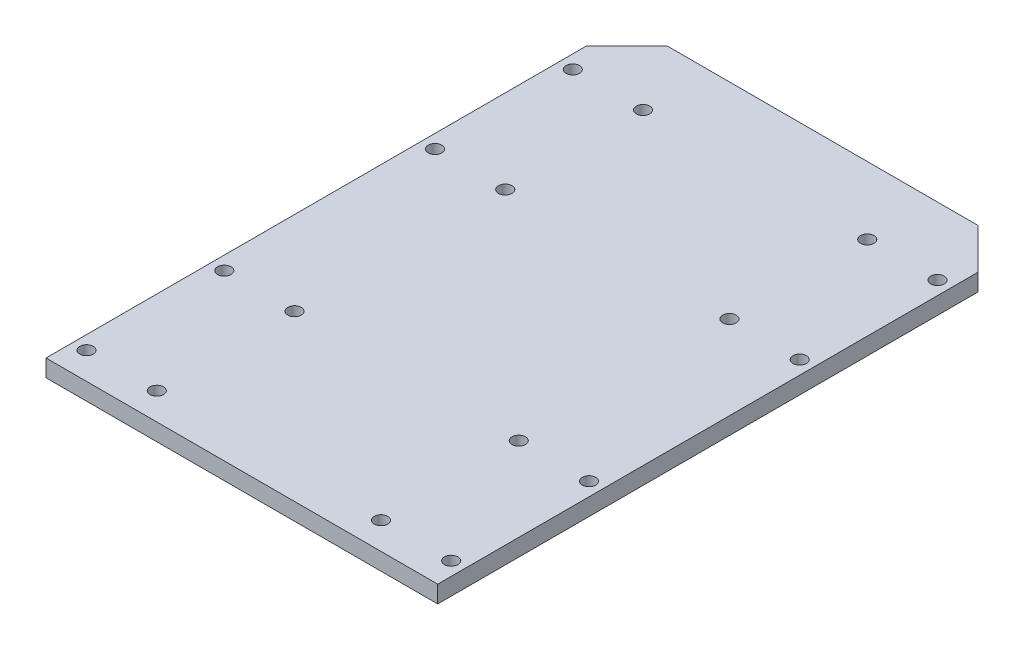
from build123d import *

# Parameters (mm, degrees)
SKETCH1_R           = 2.5
BOSS_EXTRUDE1_DEPTH = 6.35


with BuildPart() as part:
    # Sketch1 → Boss-Extrude1 (new body)
    with BuildSketch(Plane(origin=(0, 0, 0), x_dir=(1, 0, 0), z_dir=(0, 1, 0))):
        Polygon((-145, 200), (-130, 215), (-15, 215), (0, 200), (0, 0), (-145, 0), align=None)
        with Locations(Location((-140, 190, 0), (0, 0, 270))):
            Circle(SKETCH1_R, mode=Mode.SUBTRACT)
        with Locations(Location((-114, 190, 0), (0, 0, 270))):
            Circle(SKETCH1_R, mode=Mode.SUBTRACT)
        with Locations(Location((-140, 139, 0), (0, 0, 270))):
            Circle(SKETCH1_R, mode=Mode.SUBTRACT)
        with Locations(Location((-114, 139, 0), (0, 0, 270))):
            Circle(SKETCH1_R, mode=Mode.SUBTRACT)
        with Locations(Location((-31, 190, 0), (0, 0, 270))):
            Circle(SKETCH1_R, mode=Mode.SUBTRACT)
        with Locations(Location((-5, 190, 0), (0, 0, 270))):
            Circle(SKETCH1_R, mode=Mode.SUBTRACT)
        with Locations(Location((-5, 139, 0), (0, 0, 270))):
            Circle(SKETCH1_R, mode=Mode.SUBTRACT)
        with Locations(Location((-31, 139, 0), (0, 0, 270))):
            Circle(SKETCH1_R, mode=Mode.SUBTRACT)
        with Locations(Location((-5, 10, 0), (0, 0, 270))):
            Circle(SKETCH1_R, mode=Mode.SUBTRACT)
        with Locations(Location((-5, 61, 0), (0, 0, 270))):
            Circle(SKETCH1_R, mode=Mode.SUBTRACT)
        with Locations(Location((-31, 61, 0), (0, 0, 270))):
            Circle(SKETCH1_R, mode=Mode.SUBTRACT)
        with Locations(Location((-31, 10, 0), (0, 0, 270))):
            Circle(SKETCH1_R, mode=Mode.SUBTRACT)
        with Locations(Location((-114, 10, 0), (0, 0, 270))):
            Circle(SKETCH1_R, mode=Mode.SUBTRACT)
        with Locations(Location((-114, 61, 0), (0, 0, 270))):
            Circle(SKETCH1_R, mode=Mode.SUBTRACT)
        with Locations(Location((-140, 10, 0), (0, 0, 270))):
            Circle(SKETCH1_R, mode=Mode.SUBTRACT)
        with Locations(Location((-140, 61, 0), (0, 0, 270))):
            Circle(SKETCH1_R, mode=Mode.SUBTRACT)
    extrude(amount=BOSS_EXTRUDE1_DEPTH)


solid = part.part
